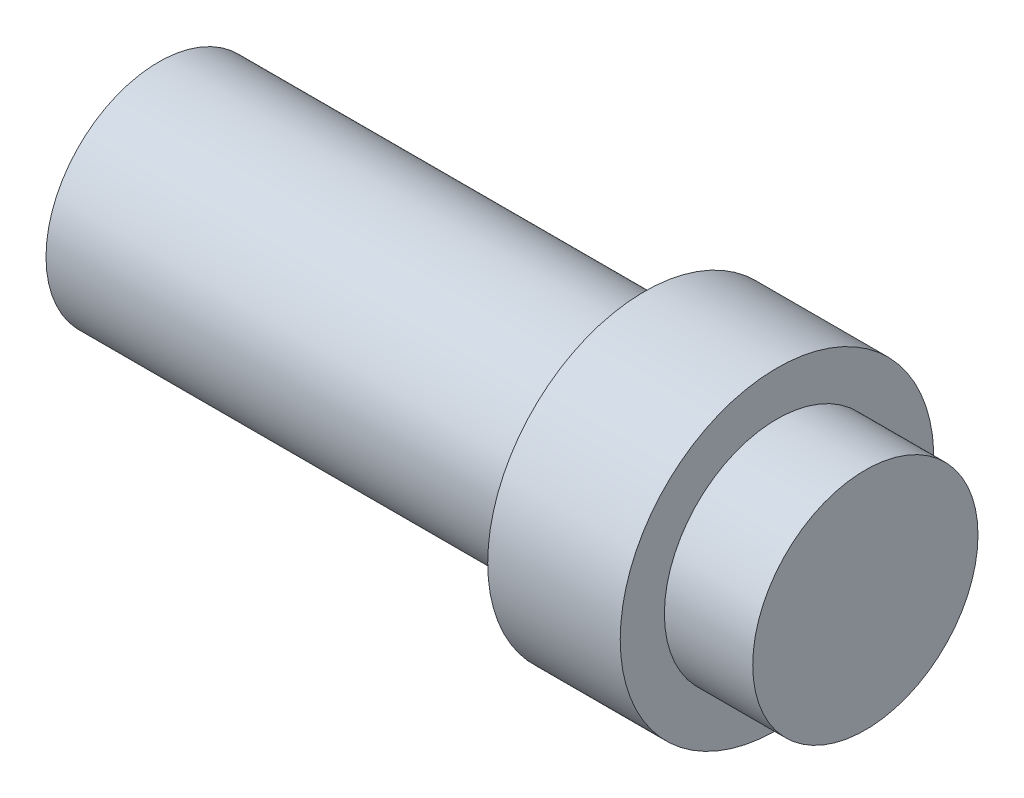
from build123d import *


with BuildPart() as part:
    # 草图1 → 旋转1 (revolve)
    with BuildSketch(Plane.XY, mode=Mode.PRIVATE) as revolve_1_sk:
        Polygon((-25, 0), (-25, 5.1), (-3, 5.1), (-3, 7.1), (3, 7.1), (3, 5.1), (7, 5.1), (7, 0), align=None)
    revolve(revolve_1_sk.sketch.rotate(Axis((-84.795984063, 0, 0), (1, 0, 0)), 90), axis=Axis((-84.795984063, 0, 0), (1, 0, 0)))


solid = part.part
